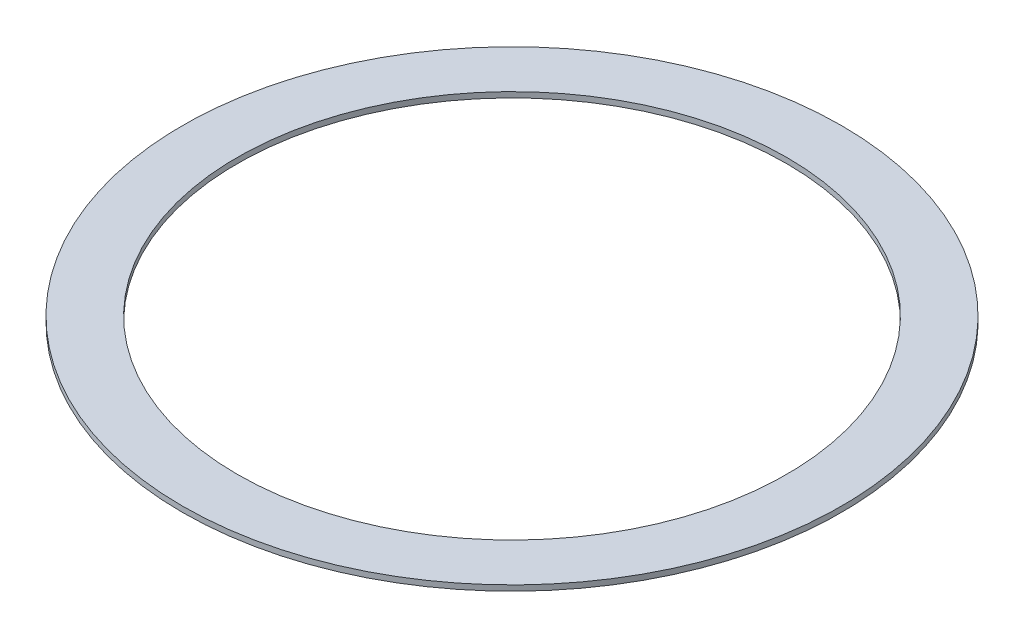
from build123d import *

# Parameters (mm, degrees)
SKETCH1_W = 0.5
SKETCH1_H = 0.05


with BuildPart() as part:
    # Sketch1 → Revolve1 (revolve)
    with BuildSketch(Plane.XY, mode=Mode.PRIVATE) as revolve1_sk:
        with Locations((2.75, 4.194232651)):
            Rectangle(SKETCH1_W, SKETCH1_H)
    revolve(revolve1_sk.sketch.rotate(Axis((0, 0, 0), (0, 1, 0)), 90), axis=Axis((0, 0, 0), (0, 1, 0)))


solid = part.part
